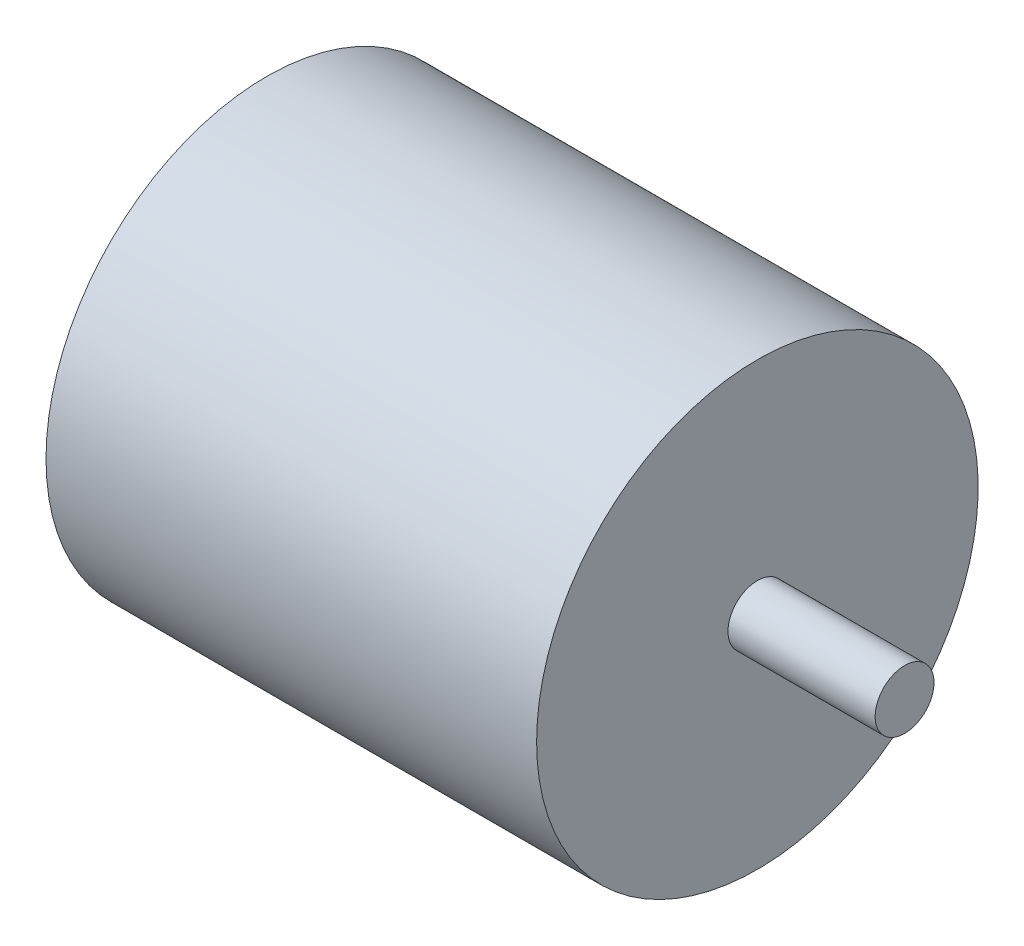
from build123d import *

# Parameters (mm, degrees)
SKETCH_1_R      = 3
EXTRUDE_1_DEPTH = 15
SKETCH_2_R      = 22.5
EXTRUDE_2_DEPTH = 50


with BuildPart() as part:
    # 草图1 → 凸台-拉伸1 (new body)
    with BuildSketch(Plane(origin=(0, 0, 0), x_dir=(0, 0, -1), z_dir=(1, 0, 0))):
        Circle(SKETCH_1_R)
    extrude(amount=EXTRUDE_1_DEPTH)

    # 草图2 → 凸台-拉伸2 (add)
    with BuildSketch(Plane.ZY):
        Circle(SKETCH_2_R)
    extrude(amount=EXTRUDE_2_DEPTH)


solid = part.part
